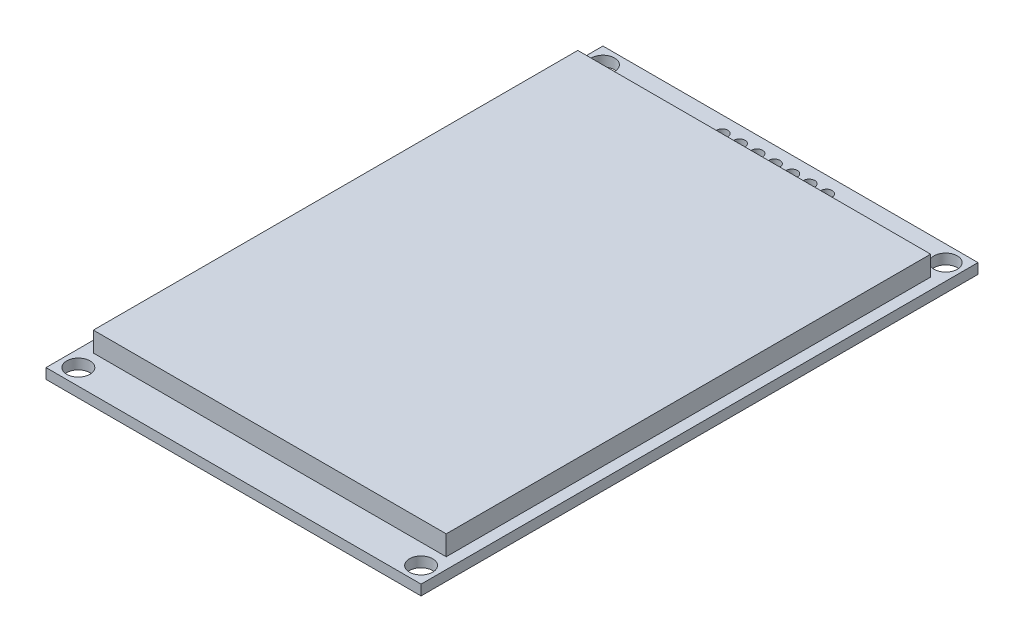
from build123d import *

# Parameters (mm, degrees)
SKETCH1_W           = 54.74
SKETCH1_H           = 81.28
SKETCH1_R           = 1.7
SKETCH1_R_2         = 0.83
BOSS_EXTRUDE1_DEPTH = 1.5
SKETCH2_W           = 51.5
SKETCH2_H           = 70.7
BOSS_EXTRUDE2_DEPTH = 2.9
BOSS_EXTRUDE3_DEPTH = 2.54


with BuildPart() as part:
    # Sketch1 → Boss-Extrude1 (new body)
    with BuildSketch(Plane(origin=(0, 0, 0), x_dir=(1, 0, 0), z_dir=(0, 1, 0))):
        Rectangle(SKETCH1_W, SKETCH1_H)
        with Locations(Location((-25.01, 38.28, 0), (0, 0, 270))):
            Circle(SKETCH1_R, mode=Mode.SUBTRACT)
        with Locations(Location((25.01, 38.28, 0), (0, 0, 90))):
            Circle(SKETCH1_R, mode=Mode.SUBTRACT)
        with Locations(Location((-25.01, -38.28, 0), (0, 0, 90))):
            Circle(SKETCH1_R, mode=Mode.SUBTRACT)
        with Locations(Location((25.01, -38.28, 0), (0, 0, 270))):
            Circle(SKETCH1_R, mode=Mode.SUBTRACT)
        with Locations(Location((0, 38.28, 0), (0, 0, 270))):
            Circle(SKETCH1_R_2, mode=Mode.SUBTRACT)
        with Locations(Location((2.54, 38.28, 0), (0, 0, 270))):
            Circle(SKETCH1_R_2, mode=Mode.SUBTRACT)
        with Locations(Location((5.08, 38.28, 0), (0, 0, 270))):
            Circle(SKETCH1_R_2, mode=Mode.SUBTRACT)
        with Locations(Location((7.62, 38.28, 0), (0, 0, 270))):
            Circle(SKETCH1_R_2, mode=Mode.SUBTRACT)
        with Locations(Location((-2.54, 38.28, 0), (0, 0, 270))):
            Circle(SKETCH1_R_2, mode=Mode.SUBTRACT)
        with Locations(Location((-5.08, 38.28, 0), (0, 0, 270))):
            Circle(SKETCH1_R_2, mode=Mode.SUBTRACT)
        with Locations(Location((-7.62, 38.28, 0), (0, 0, 270))):
            Circle(SKETCH1_R_2, mode=Mode.SUBTRACT)
    extrude(amount=BOSS_EXTRUDE1_DEPTH)

    # Sketch2 → Boss-Extrude2 (add)
    with BuildSketch(Plane(origin=(0, 1.5, 0), x_dir=(1, 0, 0), z_dir=(0, 1, 0))):
        Rectangle(SKETCH2_W, SKETCH2_H)
    extrude(amount=BOSS_EXTRUDE2_DEPTH)

    # Sketch3 → Boss-Extrude3 (add)
    with BuildSketch(Plane.XZ):
        Polygon((-6.35, -37.01), (6.35, -37.01), (8.89, -37.01), (8.89, -39.55), (6.35, -39.55), (-6.35, -39.55), (-8.89, -39.55), (-8.89, -37.01), align=None)
    extrude(amount=BOSS_EXTRUDE3_DEPTH)


solid = part.part
